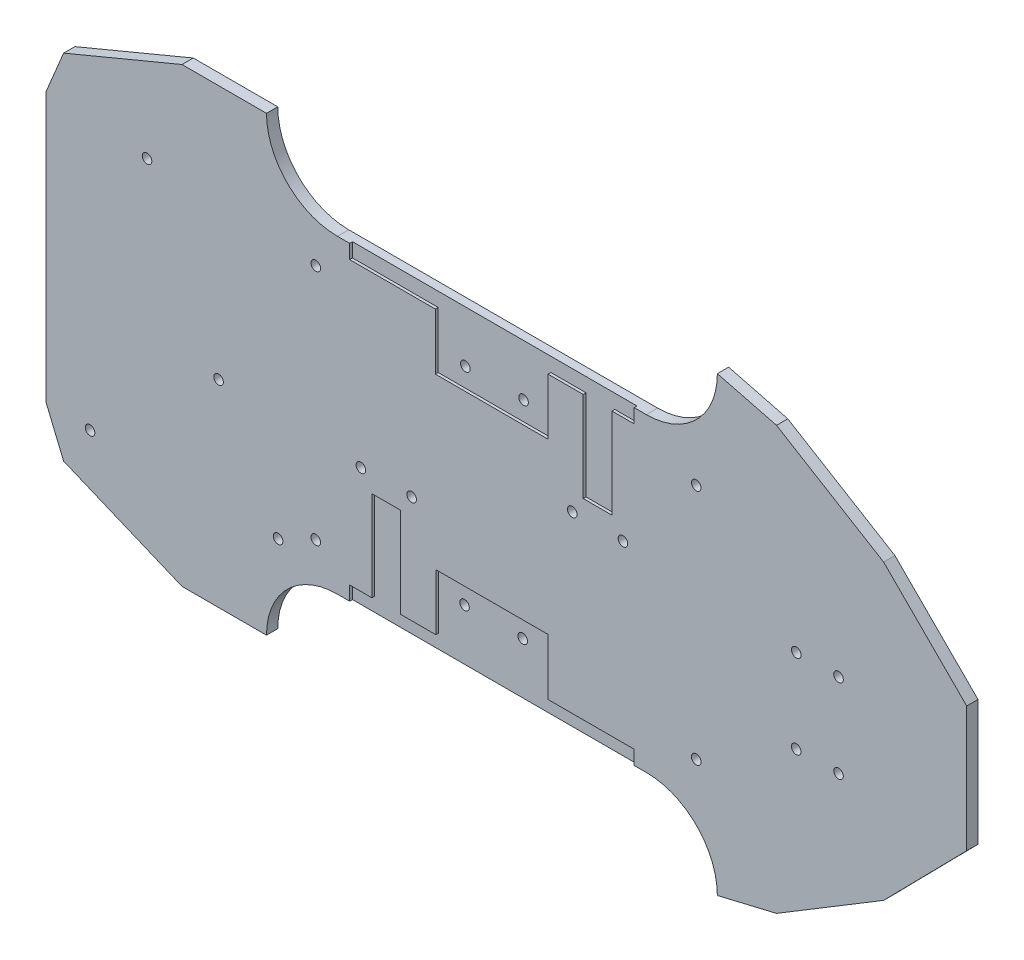
from build123d import *

# Parameters (mm, degrees)
BOSS_EXTRU_1_DEPTH      = 4
D_GAGEMENT_M2_51_D      = 2.9
D_GAGEMENT_M2_51_DEPTH  = 5
D_GAGEMENT_M2_51_TIP    = 0.871247898
D_GAGEMENT_M31_D        = 3.4
D_GAGEMENT_M31_DEPTH    = 6
D_GAGEMENT_M31_TIP      = 1.021463052
D_GAGEMENT_M32_D        = 3.4
D_GAGEMENT_M32_DEPTH    = 5
D_GAGEMENT_M32_TIP      = 1.021463052
ENL_V_MAT_EXTRU_1_DEPTH = 1
ENL_V_MAT_EXTRU_2_DEPTH = 1
D_GAGEMENT_M33_D        = 3.4
D_GAGEMENT_M33_DEPTH    = 6
D_GAGEMENT_M33_TIP      = 1.021463052
D_GAGEMENT_M34_D        = 3.4
D_GAGEMENT_M34_DEPTH    = 5
D_GAGEMENT_M34_TIP      = 1.021463052
D_GAGEMENT_M35_D        = 3.4
D_GAGEMENT_M35_DEPTH    = 5
D_GAGEMENT_M35_TIP      = 1.021463052


with BuildPart() as part:
    # Esquisse1 → Boss.-Extru.1 (new body)
    with BuildSketch(Plane.XY):
        with BuildLine():
            Line((-87.472008168, 59.584338106), (-117.472008168, 59.584338106))
            Line((-117.472008168, 59.584338106), (-159.472008168, 42.084338106))
            Line((-159.472008168, 42.084338106), (-165.722008168, 27.084338106))
            Line((-165.722008168, 27.084338106), (-165.722008168, -68.315661894))
            Line((-165.722008168, -68.315661894), (-159.472008168, -83.315661894))
            Line((-159.472008168, -83.315661894), (-117.472008168, -100.815661894))
            Line((-117.472008168, -100.815661894), (-87.472008168, -100.815661894))
            ThreePointArc((-87.472008168, -100.815661894), (-80.091099054, -82.996571008), (-62.272008168, -75.615661894))
            Line((-62.272008168, -75.615661894), (47.327991832, -75.615661894))
            ThreePointArc((47.327991832, -75.615661894), (65.147082718, -82.996571008), (72.527991832, -100.815661894))
            Line((72.527991832, -100.815661894), (93.527991832, -95.815661894))
            Line((93.527991832, -95.815661894), (131.527991832, -72.815661894))
            Line((131.527991832, -72.815661894), (161.027991832, -42.815661894))
            Line((161.027991832, -42.815661894), (161.027991832, 1.684338106))
            Line((161.027991832, 1.684338106), (131.527991832, 31.184338106))
            Line((131.527991832, 31.184338106), (93.527991832, 54.184338106))
            Line((93.527991832, 54.184338106), (72.527991832, 59.584338106))
            ThreePointArc((72.527991832, 59.584338106), (65.147082718, 41.76524722), (47.327991832, 34.384338106))
            Line((47.327991832, 34.384338106), (-62.272008168, 34.384338106))
            ThreePointArc((-62.272008168, 34.384338106), (-80.091099054, 41.76524722), (-87.472008168, 59.584338106))
        make_face()
    extrude(amount=BOSS_EXTRU_1_DEPTH)

    # Dégagement M2.51
    with Locations(Plane(origin=(0, 0, 0), x_dir=(-1, 0, 0), z_dir=(0, 0, -1))):
        with Locations((-21.027991832, -8.66564946), (-39.027991832, -8.66564946), (35.972008168, -32.565674331), (53.972008168, -32.565674331)):
            Hole(D_GAGEMENT_M2_51_D / 2, depth=D_GAGEMENT_M2_51_DEPTH)
            with Locations((0, 0, -(D_GAGEMENT_M2_51_DEPTH + D_GAGEMENT_M2_51_TIP / 2))):  # 118° drill point
                Cone(0, D_GAGEMENT_M2_51_D / 2, D_GAGEMENT_M2_51_TIP, mode=Mode.SUBTRACT)

    # Dégagement M31
    with Locations(Plane(origin=(0, 0, 0), x_dir=(-1, 0, 0), z_dir=(0, 0, -1))):
        with Locations((17.896581687, 16.134338106), (-2.752565352, 16.134338106), (53.972008168, -32.565674331), (35.972008168, -32.565674331), (18.196581687, -57.365661894), (-2.452565352, -57.365661894), (-39.027991832, -8.66564946), (-21.027991832, -8.66564946)):
            Hole(D_GAGEMENT_M31_D / 2, depth=D_GAGEMENT_M31_DEPTH)
            with Locations((0, 0, -(D_GAGEMENT_M31_DEPTH + D_GAGEMENT_M31_TIP / 2))):  # 118° drill point
                Cone(0, D_GAGEMENT_M31_D / 2, D_GAGEMENT_M31_TIP, mode=Mode.SUBTRACT)

    # Dégagement M32
    with Locations(Plane(origin=(0, 0, 0), x_dir=(-1, 0, 0), z_dir=(0, 0, -1))):
        with Locations((69.972008168, -62.728910548), (69.972008168, 21.49758676), (-65.027991832, -62.728910548), (-65.027991832, 21.49758676)):
            Hole(D_GAGEMENT_M32_D / 2, depth=D_GAGEMENT_M32_DEPTH)
            with Locations((0, 0, -(D_GAGEMENT_M32_DEPTH + D_GAGEMENT_M32_TIP / 2))):  # 118° drill point
                Cone(0, D_GAGEMENT_M32_D / 2, D_GAGEMENT_M32_TIP, mode=Mode.SUBTRACT)

    # Esquisse10 → Enlèv. mat.-Extru.1 (cut)
    with BuildSketch(Plane.XY.offset(4)):
        Polygon((43.027991832, -75.615661894), (43.027991832, -70.615661894), (12.42027445, -70.615661894), (12.42027445, -50.615661894), (-27.372008168, -50.615661894), (-27.372008168, -70.615661894), (-36.072008168, -70.615661894), (-39.872008168, -70.615661894), (-39.872008168, -38.615661894), (-50.072008168, -38.615661894), (-50.072008168, -70.615661894), (-57.972008168, -70.615661894), (-57.972008168, -75.615661894), align=None)
    extrude(amount=-ENL_V_MAT_EXTRU_1_DEPTH, mode=Mode.SUBTRACT)

    # Esquisse10<3> → Enlèv. mat.-Extru.2 (cut)
    with BuildSketch(Plane.XY.offset(4)):
        Polygon((43.027991832, 29.384338106), (43.027991832, 34.384338106), (-57.972008168, 34.384338106), (-57.972008168, 29.384338106), (-27.572008168, 29.384338106), (-27.572008168, 9.384338106), (12.427991832, 9.384338106), (12.427991832, 29.384338106), (24.927991832, 29.384338106), (24.927991832, -2.615661894), (35.127991832, -2.615661894), (35.127991832, 29.384338106), align=None)
    extrude(amount=-ENL_V_MAT_EXTRU_2_DEPTH, mode=Mode.SUBTRACT)

    # Dégagement M33
    with Locations(Plane(origin=(0, 0, 0), x_dir=(-1, 0, 0), z_dir=(0, 0, -1))):
        with Locations((104.471408589, -30.715661894), (129.871408589, 24.484338106)):
            Hole(D_GAGEMENT_M33_D / 2, depth=D_GAGEMENT_M33_DEPTH)
            with Locations((0, 0, -(D_GAGEMENT_M33_DEPTH + D_GAGEMENT_M33_TIP / 2))):  # 118° drill point
                Cone(0, D_GAGEMENT_M33_D / 2, D_GAGEMENT_M33_TIP, mode=Mode.SUBTRACT)

    # Dégagement M34
    with Locations(Plane(origin=(0, 0, 0), x_dir=(-1, 0, 0), z_dir=(0, 0, -1))):
        with Locations((-100.527991832, -41.815661894), (-115.527991832, -41.815661894), (-100.527991832, -12.115661894), (-115.527991832, -12.115661894)):
            Hole(D_GAGEMENT_M34_D / 2, depth=D_GAGEMENT_M34_DEPTH)
            with Locations((0, 0, -(D_GAGEMENT_M34_DEPTH + D_GAGEMENT_M34_TIP / 2))):  # 118° drill point
                Cone(0, D_GAGEMENT_M34_D / 2, D_GAGEMENT_M34_TIP, mode=Mode.SUBTRACT)

    # Dégagement M35
    with Locations(Plane(origin=(0, 0, 0), x_dir=(-1, 0, 0), z_dir=(0, 0, -1))):
        with Locations((150.085256822, -69.115661894), (83.358759514, -69.115661894)):
            Hole(D_GAGEMENT_M35_D / 2, depth=D_GAGEMENT_M35_DEPTH)
            with Locations((0, 0, -(D_GAGEMENT_M35_DEPTH + D_GAGEMENT_M35_TIP / 2))):  # 118° drill point
                Cone(0, D_GAGEMENT_M35_D / 2, D_GAGEMENT_M35_TIP, mode=Mode.SUBTRACT)


solid = part.part
